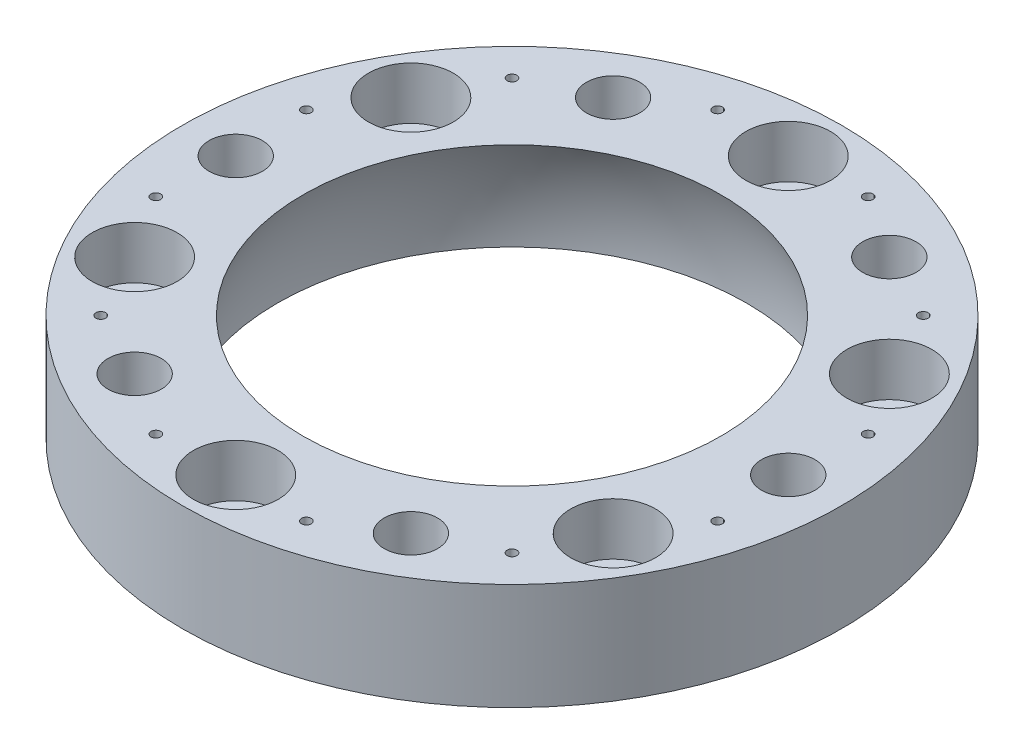
from build123d import *

# Parameters (mm, degrees)
SKETCH_1_R          = 68
SKETCH_1_R_2        = 5.5
EXTRUDE_1_DEPTH     = 60
SKETCH_2_R          = 8.75
CUT_EXTRUDE_1_DEPTH = 10.8
SKETCH_4_R          = 8.75
CUT_EXTRUDE_2_DEPTH = 10.8
SKETCH_5_R          = 68
CUT_EXTRUDE_3_DEPTH = 38
SKETCH_11_R         = 1
CUT_EXTRUDE_4_DEPTH = 99.650899641


with BuildPart() as part:
    # 草图1 → 凸台-拉伸1 (new body)
    with BuildSketch(Plane(origin=(0, 0, 0), x_dir=(1, 0, 0), z_dir=(0, 1, 0))):
        Circle(SKETCH_1_R)
        with Locations((0, 57)):
            Circle(SKETCH_1_R_2, mode=Mode.SUBTRACT)
        with Locations((28.5, 49.363448016)):
            Circle(SKETCH_1_R_2, mode=Mode.SUBTRACT)
        with Locations((49.363448016, 28.5)):
            Circle(SKETCH_1_R_2, mode=Mode.SUBTRACT)
        with Locations((57, 0)):
            Circle(SKETCH_1_R_2, mode=Mode.SUBTRACT)
        with Locations((49.363448016, -28.5)):
            Circle(SKETCH_1_R_2, mode=Mode.SUBTRACT)
        with Locations((28.5, -49.363448016)):
            Circle(SKETCH_1_R_2, mode=Mode.SUBTRACT)
        with Locations((0, -57)):
            Circle(SKETCH_1_R_2, mode=Mode.SUBTRACT)
        with Locations((-28.5, -49.363448016)):
            Circle(SKETCH_1_R_2, mode=Mode.SUBTRACT)
        with Locations((-49.363448016, -28.5)):
            Circle(SKETCH_1_R_2, mode=Mode.SUBTRACT)
        with Locations((-57, 0)):
            Circle(SKETCH_1_R_2, mode=Mode.SUBTRACT)
        with Locations((-49.363448016, 28.5)):
            Circle(SKETCH_1_R_2, mode=Mode.SUBTRACT)
        with Locations((-28.5, 49.363448016)):
            Circle(SKETCH_1_R_2, mode=Mode.SUBTRACT)
    extrude(amount=EXTRUDE_1_DEPTH)

    # 草图2 → 切除-拉伸1 (cut)
    with BuildSketch(Plane(origin=(0, 60, 0), x_dir=(1, 0, 0), z_dir=(0, 1, 0))):
        with Locations((0, 57)):
            Circle(SKETCH_2_R)
        with Locations((49.363448016, 28.5)):
            Circle(SKETCH_2_R)
        with Locations((49.363448016, -28.5)):
            Circle(SKETCH_2_R)
        with Locations((0, -57)):
            Circle(SKETCH_2_R)
        with Locations((-49.363448016, -28.5)):
            Circle(SKETCH_2_R)
        with Locations((-49.363448016, 28.5)):
            Circle(SKETCH_2_R)
    extrude(amount=-CUT_EXTRUDE_1_DEPTH, mode=Mode.SUBTRACT)

    # 草图4 → 切除-拉伸2 (cut)
    with BuildSketch(Plane.XZ):
        with Locations((28.5, 49.363448016)):
            Circle(SKETCH_4_R)
        with Locations((57, 0)):
            Circle(SKETCH_4_R)
        with Locations((28.5, -49.363448016)):
            Circle(SKETCH_4_R)
        with Locations((-28.5, -49.363448016)):
            Circle(SKETCH_4_R)
        with Locations((-57, 0)):
            Circle(SKETCH_4_R)
        with Locations((-28.5, 49.363448016)):
            Circle(SKETCH_4_R)
    extrude(amount=-CUT_EXTRUDE_2_DEPTH, mode=Mode.SUBTRACT)

    # 草图5 → 切除-拉伸3 (cut)
    with BuildSketch(Plane.XZ):
        Circle(SKETCH_5_R)
    extrude(amount=-CUT_EXTRUDE_3_DEPTH, mode=Mode.SUBTRACT)

    # 草图10 → 切除-旋转6 (revolve, cut)
    with BuildSketch(Plane(origin=(0, 0, 0), x_dir=(-1, 0, 0), z_dir=(0, 0, -1))):
        with BuildLine():
            Line((0, 86.414873748), (0, -10.414873748))
            ThreePointArc((0, -10.414873748), (-48.414873748, 38), (0, 86.414873748))
        make_face()
    revolve(axis=Axis((0, 86.414873748, 0), (0, -1, 0)), mode=Mode.SUBTRACT)

    # 草图11 → 切除-拉伸4 (cut, through all)
    with BuildSketch(Plane(origin=(0, 60, 0), x_dir=(1, 0, 0), z_dir=(0, 1, 0))):
        with Locations((15.529142706, 57.955549577)):
            Circle(SKETCH_11_R)
        with Locations((42.426406871, 42.426406871)):
            Circle(SKETCH_11_R)
        with Locations((57.955549577, 15.529142706)):
            Circle(SKETCH_11_R)
        with Locations((57.955549577, -15.529142706)):
            Circle(SKETCH_11_R)
        with Locations((42.426406871, -42.426406871)):
            Circle(SKETCH_11_R)
        with Locations((15.529142706, -57.955549577)):
            Circle(SKETCH_11_R)
        with Locations((-15.529142706, -57.955549577)):
            Circle(SKETCH_11_R)
        with Locations((-42.426406871, -42.426406871)):
            Circle(SKETCH_11_R)
        with Locations((-57.955549577, -15.529142706)):
            Circle(SKETCH_11_R)
        with Locations((-57.955549577, 15.529142706)):
            Circle(SKETCH_11_R)
        with Locations((-42.426406871, 42.426406871)):
            Circle(SKETCH_11_R)
        with Locations((-15.529142706, 57.955549577)):
            Circle(SKETCH_11_R)
    extrude(amount=-CUT_EXTRUDE_4_DEPTH, mode=Mode.SUBTRACT)


solid = part.part
